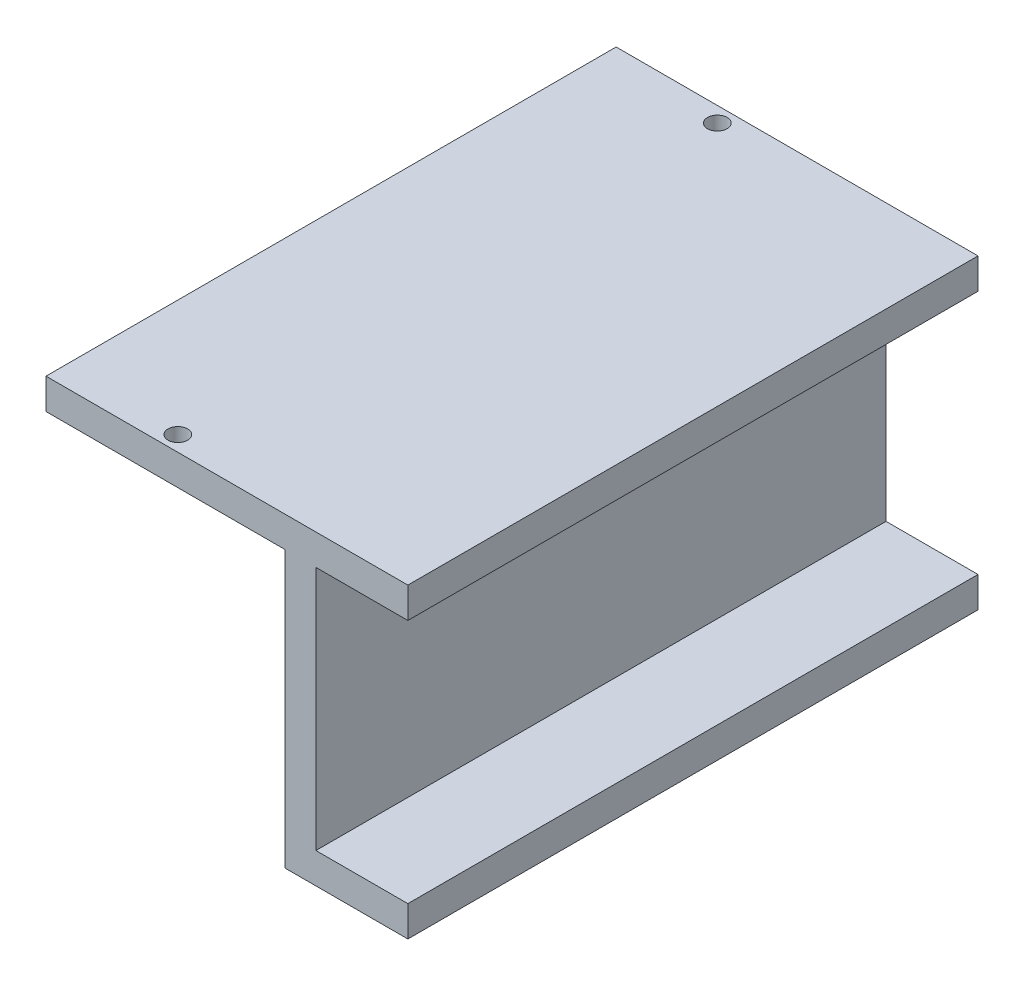
from build123d import *

# Parameters (mm, degrees)
BOSS_EXTRU_1_DEPTH      = 93
ESQUISSE2_R             = 1.6
ENL_V_MAT_EXTRU_1_DEPTH = 121.966784717


with BuildPart() as part:
    # Esquisse1 → Boss.-Extru.1 (new body)
    with BuildSketch(Plane.XY):
        Polygon((-20, -469.409867617), (-59.025104869, -469.409867617), (-59.025104869, -464.409867617), (0, -464.409867617), (0, -469.409867617), (-15, -469.409867617), (-15, -509.409867617), (0, -509.409867617), (0, -514.409867617), (-20, -514.409867617), align=None)
    extrude(amount=-BOSS_EXTRU_1_DEPTH)

    # Esquisse2 → Enlèv. mat.-Extru.1 (cut, through all)
    with BuildSketch(Plane(origin=(0, -464.409867617, 0), x_dir=(1, 0, 0), z_dir=(0, 1, 0))):
        with Locations(Location((-40.025104869, 90.5, 0), (0, 0, 270))):
            Circle(ESQUISSE2_R)
        with Locations(Location((-40.025104869, 2.5, 0), (0, 0, 270))):
            Circle(ESQUISSE2_R)
    extrude(amount=-ENL_V_MAT_EXTRU_1_DEPTH, mode=Mode.SUBTRACT)


solid = part.part
